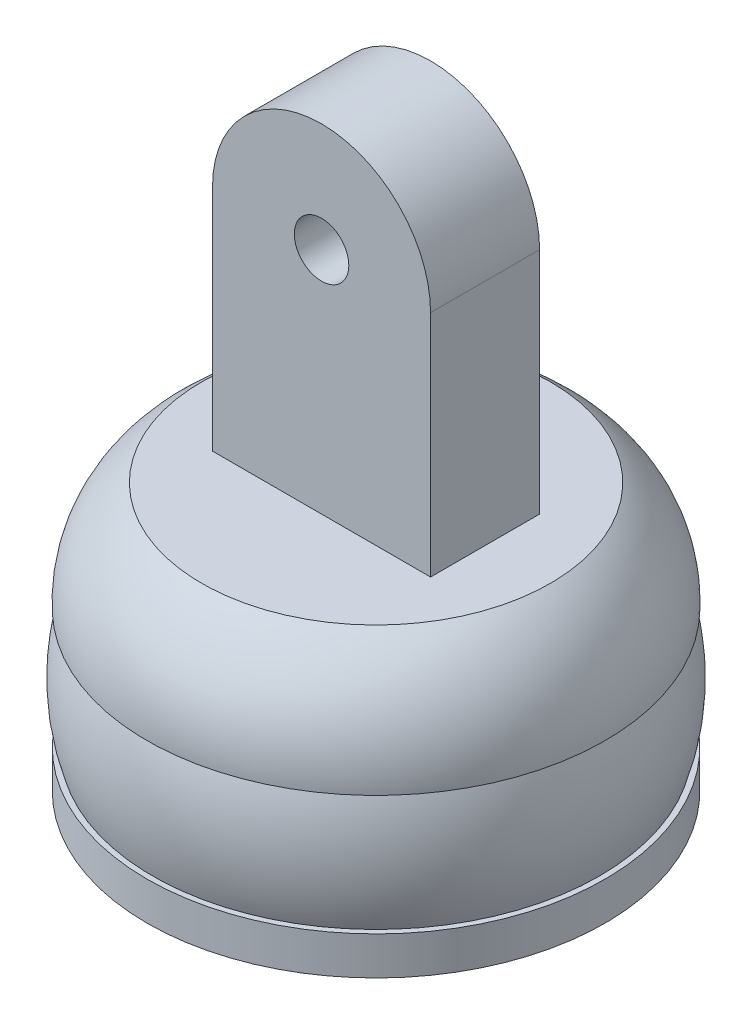
from build123d import *

# Parameters (mm, degrees)
SKETCH1_R            = 21
BOSS_EXTRUDE1_DEPTH  = 3.5
SKETCH5_R            = 2.5
BOSS_EXTRUDE2_DEPTH  = 5
SKETCH6_R            = 5
SKETCH6_R_2          = 2.5
BOSS_EXTRUDE3_DEPTH  = 2.5
SKETCH7_R            = 17.5
BOSS_EXTRUDE4_DEPTH  = 0.75
SKETCH8_R            = 5
BOSS_EXTRUDE5_DEPTH  = 2.5
SKETCH10_R           = 1.125
SKETCH10_R_2         = 0.625
BOSS_EXTRUDE12_DEPTH = 0.5
CIRPATTERN1_COUNT    = 30


with BuildPart() as part:
    # Sketch1 → Boss-Extrude1 (new body)
    with BuildSketch(Plane(origin=(0, 0, 0), x_dir=(1, 0, 0), z_dir=(0, 1, 0))):
        with Locations(Location((0, 0, 0), (0, 0, 270))):
            Circle(SKETCH1_R)
    extrude(amount=BOSS_EXTRUDE1_DEPTH)

    # Sketch2 → Revolve3 (revolve)
    with BuildSketch(Plane.XY, mode=Mode.PRIVATE) as revolve3_sk:
        with BuildLine():
            Line((0, 3.5), (-20.5, 3.5))
            ThreePointArc((-20.5, 3.5), (-21.360863499, 9), (-20.5, 14.5))
            Line((-20.5, 14.5), (0, 14.5))
            Line((0, 14.5), (0, 3.5))
        make_face()
    revolve(revolve3_sk.sketch.rotate(Axis((0, 3.5, 0), (0, 1, 0)), 180), axis=Axis((0, 3.5, 0), (0, 1, 0)))

    # Sketch4 → Revolve4 (revolve)
    with BuildSketch(Plane.XY):
        with BuildLine():
            Line((0, 14.5), (21, 14.5))
            ThreePointArc((21, 14.5), (19.802282406, 20.151141203), (16, 24.5))
            Line((16, 24.5), (0, 24.5))
            Line((0, 24.5), (0, 14.5))
        make_face()
    revolve(axis=Axis((0, 14.5, 0), (0, 1, 0)))

    # Sketch5 → Boss-Extrude2 (add, symmetric)
    with BuildSketch(Plane.XY):
        with BuildLine():
            Line((0, 24.5), (10, 24.5))
            Line((10, 24.5), (10, 45.5))
            ThreePointArc((10, 45.5), (0, 55.5), (-10, 45.5))
            Line((-10, 45.5), (-10, 24.5))
            Line((-10, 24.5), (0, 24.5))
        make_face()
        with Locations((0, 45.5)):
            Circle(SKETCH5_R, mode=Mode.SUBTRACT)
    extrude(amount=BOSS_EXTRUDE2_DEPTH, both=True)

    # Sketch6 → Boss-Extrude3 (add, symmetric)
    with BuildSketch(Plane(origin=(0, 0, -5), x_dir=(-1, 0, 0), z_dir=(0, 0, -1))):
        with Locations(Location((0, 45.5, 0), (0, 0, 180))):
            Circle(SKETCH6_R)
        with Locations((0, 45.5)):
            Circle(SKETCH6_R_2, mode=Mode.SUBTRACT)
    extrude(amount=BOSS_EXTRUDE3_DEPTH, both=True)

    # Sketch7 → Boss-Extrude4 (add, symmetric)
    with BuildSketch(Plane.XZ):
        with Locations(Location((0, 0, 0), (0, 0, 90))):
            Circle(SKETCH7_R)
    extrude(amount=BOSS_EXTRUDE4_DEPTH, both=True)

    # Sketch8 → Boss-Extrude5 (add, symmetric)
    with BuildSketch(Plane(origin=(0, -0.75, 0), x_dir=(-1, 0, 0), z_dir=(0, -1, 0))):
        with Locations(Location((0, 0, 0), (0, 0, 90))):
            Circle(SKETCH8_R)
    extrude(amount=BOSS_EXTRUDE5_DEPTH, both=True)

    # Sketch10 → Boss-Extrude12 (add)
    with BuildSketch(Plane.XZ):
        with Locations(Location((19.148756021, 0, 0), (0, 0, 90))):
            Circle(SKETCH10_R)
        with Locations(Location((19.148756021, 0, 0), (0, 0, 270))):
            Circle(SKETCH10_R_2, mode=Mode.SUBTRACT)
    boss_extrude12 = extrude(amount=BOSS_EXTRUDE12_DEPTH)

    # CirPattern1: Boss-Extrude12 ×30 about axis
    cirpattern1_axis = Axis((0, 0, 0), (0, 1, 0))
    for i in range(1, CIRPATTERN1_COUNT):
        add(boss_extrude12.rotate(cirpattern1_axis, i * 360 / CIRPATTERN1_COUNT))


solid = part.part
